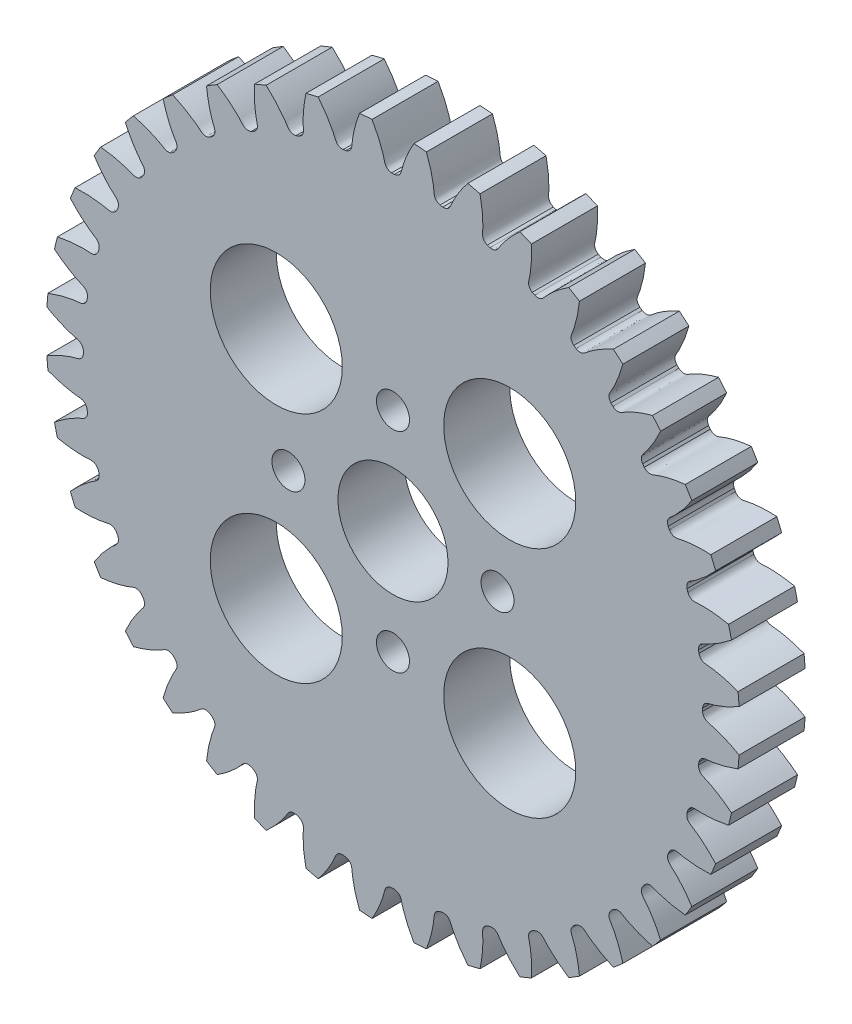
from build123d import *

# Parameters (mm, degrees)
SKETCH_1_R               = 31.5
EXTRUDE_1_DEPTH          = 6
CUT_EXTRUDE_1_DEPTH      = 45.949972191
PATTERN_CIRCULAR_1_COUNT = 40
SKETCH_4_R               = 5
CUT_EXTRUDE_2_DEPTH      = 10
SKETCH_5_R               = 1.5
CUT_EXTRUDE_3_DEPTH      = 10
SKETCH_6_R               = 6
CUT_EXTRUDE_4_DEPTH      = 10


with BuildPart() as part:
    # 草图1 → 凸台-拉伸1 (new body)
    with BuildSketch(Plane.XY):
        Circle(SKETCH_1_R)
    extrude(amount=EXTRUDE_1_DEPTH)

    # 草图2 → 切除-拉伸1 (cut, through all)
    with BuildSketch(Plane.XY):
        with BuildLine():
            ThreePointArc((0.12688632, 28.124713774), (0, 28.125), (-0.12688632, 28.124713774))
            add(Edge.make_bspline(
                [(-0.12688632, 28.124713774), (-0.683497558, 28.206073645), (-0.734235619, 28.605728214), (-0.850457527, 29.034290725), (-0.890884328, 29.173898162), (-0.937559349, 29.323378875), (-0.990751841, 29.482610017), (-1.050910991, 29.651363858), (-1.118425001, 29.829427882), (-1.193692384, 30.016569224), (-1.277100456, 30.212545387), (-1.369031239, 30.417101298), (-1.469859323, 30.629970396), (-1.57995208, 30.85087454), (-1.6996692, 31.07952428), (-1.829362434, 31.315619028), (-1.969375276, 31.55884727), (-2.120042671, 31.808886773), (-2.281690728, 32.06540481), (-2.454636432, 32.328058377), (-2.639187365, 32.596494437), (-2.835641431, 32.87035015), (-3.044286592, 33.14925313), (-3.265400603, 33.43282169), (-3.499250756, 33.720665111), (-3.746093635, 34.012383904), (-4.006174863, 34.307570083), (-4.279728896, 34.605807448), (-4.566978684, 34.906671872), (-4.973820818, 35.316084165), (-5.292282709, 35.617656697), (-5.511200014, 35.817020369)],
                knots=[0, 0, 0, 0, 0.110656833, 0.124738805, 0.140005423, 0.156456686, 0.174092594, 0.192913148, 0.212918347, 0.234108191, 0.25648268, 0.280041814, 0.304785594, 0.330714019, 0.357827089, 0.386124804, 0.415607165, 0.446274171, 0.478125822, 0.511162118, 0.545383059, 0.580788646, 0.617378878, 0.655153755, 0.694113277, 0.734257445, 0.775586258, 0.818099716, 0.861797819, 0.906680567, 1, 1, 1, 1], degree=3))
            ThreePointArc((-5.511200014, 35.817020369), (0, 36.238546793), (5.511200014, 35.817020369))
            add(Edge.make_bspline(
                [(0.12688632, 28.124713774), (0.683497558, 28.206073645), (0.734235619, 28.605728214), (0.850457527, 29.034290725), (0.890884328, 29.173898162), (0.937559349, 29.323378875), (0.990751841, 29.482610017), (1.050910991, 29.651363858), (1.118425001, 29.829427882), (1.193692384, 30.016569224), (1.277100456, 30.212545387), (1.369031239, 30.417101298), (1.469859323, 30.629970396), (1.57995208, 30.85087454), (1.6996692, 31.07952428), (1.829362434, 31.315619028), (1.969375276, 31.55884727), (2.120042671, 31.808886773), (2.281690728, 32.06540481), (2.454636432, 32.328058377), (2.639187365, 32.596494437), (2.835641431, 32.87035015), (3.044286592, 33.14925313), (3.265400603, 33.43282169), (3.499250756, 33.720665111), (3.746093635, 34.012383904), (4.006174863, 34.307570083), (4.279728896, 34.605807448), (4.566978684, 34.906671872), (4.973820818, 35.316084165), (5.292282709, 35.617656697), (5.511200014, 35.817020369)],
                knots=[0, 0, 0, 0, 0.110656833, 0.124738805, 0.140005423, 0.156456686, 0.174092594, 0.192913148, 0.212918347, 0.234108191, 0.25648268, 0.280041814, 0.304785594, 0.330714019, 0.357827089, 0.386124804, 0.415607165, 0.446274171, 0.478125822, 0.511162118, 0.545383059, 0.580788646, 0.617378878, 0.655153755, 0.694113277, 0.734257445, 0.775586258, 0.818099716, 0.861797819, 0.906680567, 1, 1, 1, 1], degree=3))
        make_face()
    cut_extrude_1 = extrude(amount=CUT_EXTRUDE_1_DEPTH, mode=Mode.SUBTRACT)

    # 阵列(圆周)1: 切除-拉伸1 ×40 about axis
    pattern_circular_1_axis = Axis((0, 0, 6), (0, 0, -1))
    for i in range(1, PATTERN_CIRCULAR_1_COUNT):
        add(cut_extrude_1.rotate(pattern_circular_1_axis, i * 360 / PATTERN_CIRCULAR_1_COUNT), mode=Mode.SUBTRACT)

    # 草图4 → 切除-拉伸2 (cut)
    with BuildSketch(Plane.XY.offset(6)):
        Circle(SKETCH_4_R)
    extrude(amount=-CUT_EXTRUDE_2_DEPTH, mode=Mode.SUBTRACT)

    # 草图5 → 切除-拉伸3 (cut)
    with BuildSketch(Plane.XY.offset(6)):
        with Locations((0, 9.5)):
            Circle(SKETCH_5_R)
        with Locations((9.5, 0)):
            Circle(SKETCH_5_R)
        with Locations((0, -9.5)):
            Circle(SKETCH_5_R)
        with Locations((-9.5, 0)):
            Circle(SKETCH_5_R)
    extrude(amount=-CUT_EXTRUDE_3_DEPTH, mode=Mode.SUBTRACT)

    # 草图6 → 切除-拉伸4 (cut)
    with BuildSketch(Plane.XY.offset(6)):
        with Locations((10.606601718, 10.606601718)):
            Circle(SKETCH_6_R)
        with Locations((10.606601718, -10.606601718)):
            Circle(SKETCH_6_R)
        with Locations((-10.606601718, -10.606601718)):
            Circle(SKETCH_6_R)
        with Locations((-10.606601718, 10.606601718)):
            Circle(SKETCH_6_R)
    extrude(amount=-CUT_EXTRUDE_4_DEPTH, mode=Mode.SUBTRACT)


solid = part.part
